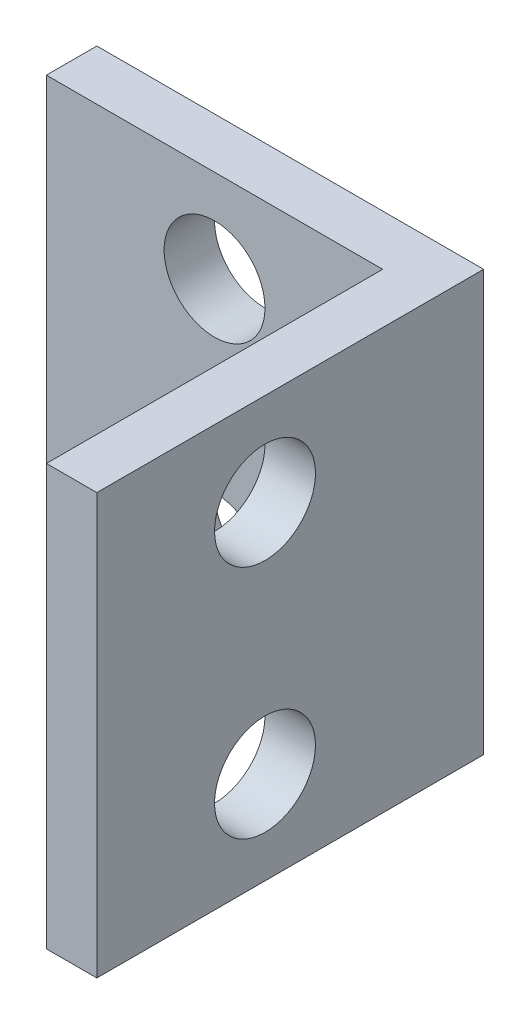
from build123d import *

# Parameters (mm, degrees)
SKETCH1_W           = 20
SKETCH1_H           = 25
BOSS_EXTRUDE1_DEPTH = 3
SKETCH3_W           = 23
SKETCH3_H           = 25
BOSS_EXTRUDE2_DEPTH = 3
SKETCH4_R           = 3
CUT_EXTRUDE1_DEPTH  = 27.930466019
SKETCH5_R           = 3
CUT_EXTRUDE2_DEPTH  = 33.94313282


with BuildPart() as part:
    # Sketch1 → Boss-Extrude1 (new body)
    with BuildSketch(Plane.XY):
        Rectangle(SKETCH1_W, SKETCH1_H)
    extrude(amount=BOSS_EXTRUDE1_DEPTH)

    # Sketch3 → Boss-Extrude2 (add)
    with BuildSketch(Plane(origin=(10, 0, 0), x_dir=(0, 0, -1), z_dir=(1, 0, 0))):
        with Locations((-11.5, 0)):
            Rectangle(SKETCH3_W, SKETCH3_H)
    extrude(amount=BOSS_EXTRUDE2_DEPTH)

    # Sketch4 → Cut-Extrude1 (cut, through all)
    with BuildSketch(Plane.XY.offset(3)):
        with Locations((0, 7)):
            Circle(SKETCH4_R)
        with Locations(Location((0, -7, 0), (0, 0, 180))):
            Circle(SKETCH4_R)
    extrude(amount=-CUT_EXTRUDE1_DEPTH, mode=Mode.SUBTRACT)

    # Sketch5 → Cut-Extrude2 (cut, through all)
    with BuildSketch(Plane.ZY.offset(-10)):
        with Locations((13, 7)):
            Circle(SKETCH5_R)
        with Locations(Location((13, -7, 0), (0, 0, 180))):
            Circle(SKETCH5_R)
    extrude(amount=-CUT_EXTRUDE2_DEPTH, mode=Mode.SUBTRACT)


solid = part.part
